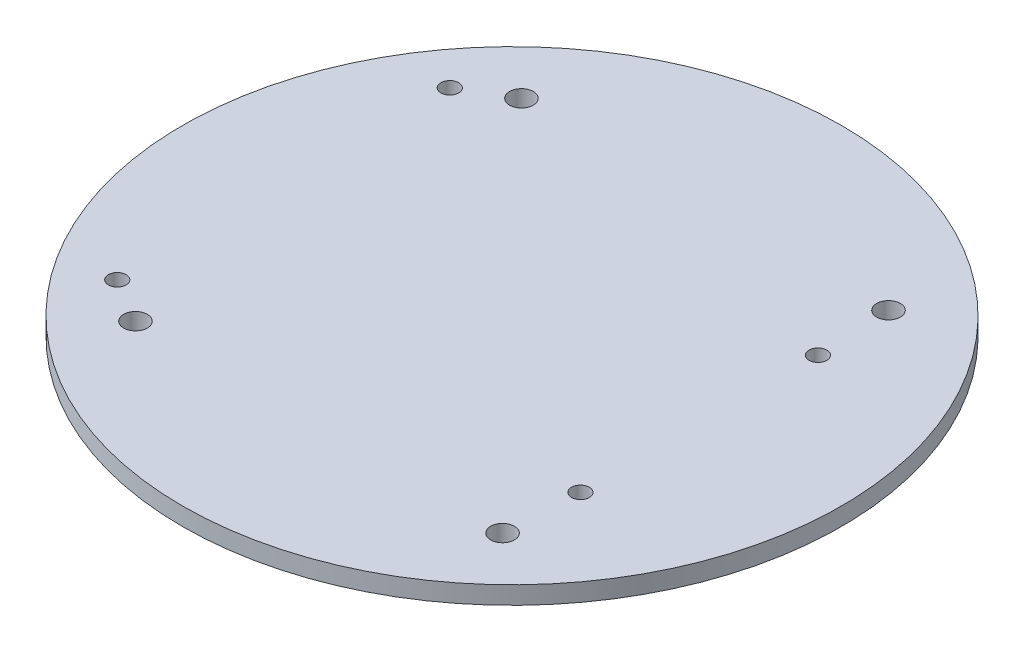
from build123d import *

# Parameters (mm, degrees)
SKETCH7_R                              = 55.5
BOSS_EXTRUDE1_DEPTH                    = 3
F_3_0MM_TRANSITIONAL_DOWEL_HOLE1_D     = 3
F_3_0MM_TRANSITIONAL_DOWEL_HOLE1_DEPTH = 25.4
F_3_0MM_TRANSITIONAL_DOWEL_HOLE1_TIP   = 0.901290929
F_4_0MM_DOWEL_HOLE1_D                  = 4
F_4_0MM_DOWEL_HOLE1_DEPTH              = 25.4
F_4_0MM_DOWEL_HOLE1_TIP                = 1.201721238


with BuildPart() as part:
    # Sketch7 → Boss-Extrude1 (new body)
    with BuildSketch(Plane(origin=(0, 0, 0), x_dir=(1, 0, 0), z_dir=(0, 1, 0))):
        with Locations(Location((0, 0, 0), (0, 0, 270))):
            Circle(SKETCH7_R)
    extrude(amount=BOSS_EXTRUDE1_DEPTH)

    # Ø3.0mm Transitional Dowel Hole1
    with Locations(Plane(origin=(0, 3, 0), x_dir=(1, 0, 0), z_dir=(0, 1, 0))):
        with Locations((-38.476262074, 27.999994228), (31.523738554, 19.999999725), (31.523741695, -20.000000275), (-38.476257677, -28.000005772)):
            Hole(F_3_0MM_TRANSITIONAL_DOWEL_HOLE1_D / 2, depth=F_3_0MM_TRANSITIONAL_DOWEL_HOLE1_DEPTH)
            with Locations((0, 0, -(F_3_0MM_TRANSITIONAL_DOWEL_HOLE1_DEPTH + F_3_0MM_TRANSITIONAL_DOWEL_HOLE1_TIP / 2))):  # 118° drill point
                Cone(0, F_3_0MM_TRANSITIONAL_DOWEL_HOLE1_D / 2, F_3_0MM_TRANSITIONAL_DOWEL_HOLE1_TIP, mode=Mode.SUBTRACT)

    # Ø4.0mm Dowel Hole1
    with Locations(Plane(origin=(0, 3, 0), x_dir=(1, 0, 0), z_dir=(0, 1, 0))):
        with Locations((-30.906824904, 32.5), (30.906824904, 32.5), (30.906824904, -32.5), (-30.906824904, -32.5)):
            Hole(F_4_0MM_DOWEL_HOLE1_D / 2, depth=F_4_0MM_DOWEL_HOLE1_DEPTH)
            with Locations((0, 0, -(F_4_0MM_DOWEL_HOLE1_DEPTH + F_4_0MM_DOWEL_HOLE1_TIP / 2))):  # 118° drill point
                Cone(0, F_4_0MM_DOWEL_HOLE1_D / 2, F_4_0MM_DOWEL_HOLE1_TIP, mode=Mode.SUBTRACT)


solid = part.part
